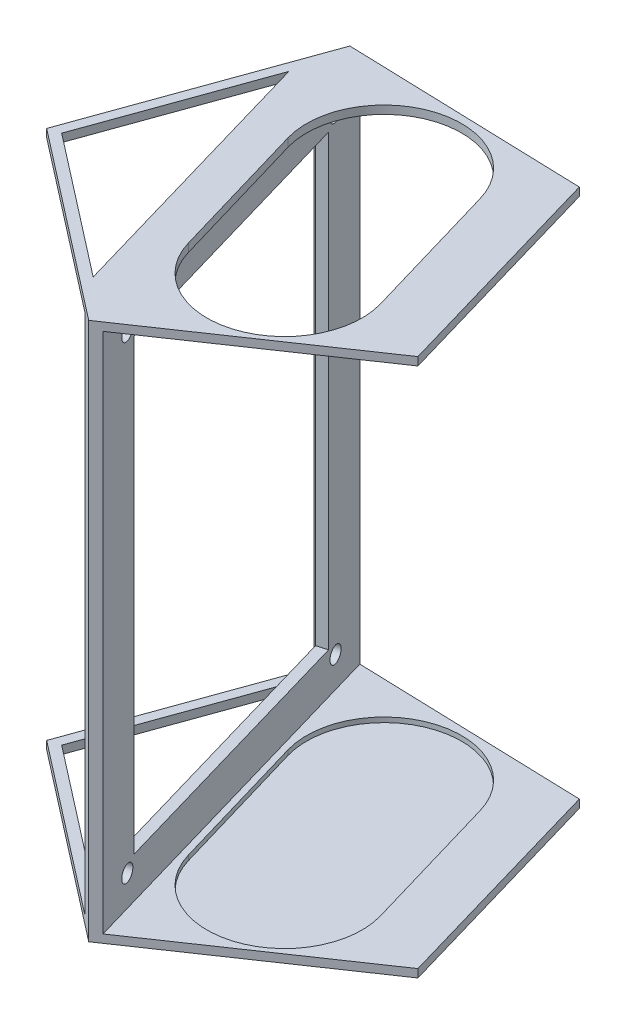
from build123d import *

# Parameters (mm, degrees)
BOSS_EXTRUDE1_DEPTH            = 1
BOSS_EXTRUDE2_DEPTH            = 65
SKETCH4_W                      = 40
SKETCH4_H                      = 60
CUT_EXTRUDE1_DEPTH             = 1.5
SKETCH5_W                      = 35
SKETCH5_H                      = 55
CUT_EXTRUDE2_DEPTH             = 1.3
BOSS_EXTRUDE3_DEPTH            = 1
CUT_EXTRUDE3_REACH             = 75.478
CUT_EXTRUDE3_DIRECTION_2_REACH = 75.478
CUT_EXTRUDE4_DEPTH             = 0.6
CUT_EXTRUDE4_DIRECTION_2_REACH = 75.478
SKETCH8_R                      = 1
CUT_EXTRUDE5_DEPTH             = 1.3


with BuildPart() as part:
    # Sketch1 → Boss-Extrude1 (new body)
    with BuildSketch(Plane(origin=(0, 0, 0), x_dir=(1, 0, 0), z_dir=(0, 1, 0))):
        Polygon((23.261119363, -8.370540245), (15.148938036, 19.535999959), (-13.898560763, 20.444452223), (-23.738720982, -6.900633603), (-0.772775653, -24.709278334), align=None)
    extrude(amount=BOSS_EXTRUDE1_DEPTH)

    # Sketch2 → Boss-Extrude2 (add)
    with BuildSketch(Plane(origin=(0, 1, 0), x_dir=(1, 0, 0), z_dir=(0, 1, 0))):
        Polygon((-2.923895425, -23.04122038), (-0.772775653, -24.709278334), (-13.898560763, 20.444452223), (-14.820245584, 17.883157492), align=None)
        Polygon((-13.898560763, 20.444452223), (-0.772775653, -24.709278334), (0.270689735, -23.999909017), (-12.637422708, 20.405010489), align=None)
    extrude(amount=BOSS_EXTRUDE2_DEPTH)

    # Sketch4 → Cut-Extrude1 (cut)
    with BuildSketch(Plane(origin=(-8.872070504, 0, 2.579031444), x_dir=(0.2791364928440536, 0, 0.9602514349704049), z_dir=(-0.9602514349704049, 0, 0.2791364928440536))):
        with Locations((0, 33.5)):
            Rectangle(SKETCH4_W, SKETCH4_H)
    extrude(amount=-CUT_EXTRUDE1_DEPTH, mode=Mode.SUBTRACT)

    # Sketch5 → Cut-Extrude2 (cut)
    with BuildSketch(Plane(origin=(-7.431693352, 0, 2.160326705), x_dir=(0.2791364928440537, 0, 0.9602514349704049), z_dir=(-0.9602514349704049, 0, 0.2791364928440537))):
        with Locations((0, 33.5)):
            Rectangle(SKETCH5_W, SKETCH5_H)
    extrude(amount=-CUT_EXTRUDE2_DEPTH, mode=Mode.SUBTRACT)

    # Sketch7 → Boss-Extrude3 (add)
    with BuildSketch(Plane(origin=(0, 66, 0), x_dir=(1, 0, 0), z_dir=(0, 1, 0))):
        Polygon((-0.772775653, -24.709278334), (23.261119363, -8.370540245), (15.148938036, 19.535999959), (-13.898560763, 20.444452223), (-23.738720982, -6.900633603), align=None)
    extrude(amount=-BOSS_EXTRUDE3_DEPTH)

    # Cut-Extrude3: up to this face of the body (flat: up to its plane)
    cut_extrude3_end = Plane(part.part.faces().sort_by_distance((0, 66, 0))[0])
    # Sketch6 → Cut-Extrude3 (cut, up to the picked face)
    with BuildSketch(Plane(origin=(0, 1, 0), x_dir=(1, 0, 0), z_dir=(0, 1, 0)), mode=Mode.PRIVATE) as cut_extrude3_sk1:
        Polygon((-22.314397723, -6.486595587), (-5.107109693, -19.829764132), (-14.941634759, 14.001773661), align=None)
    cut_extrude3_tool1 = split(extrude(cut_extrude3_sk1.sketch, amount=CUT_EXTRUDE3_REACH, mode=Mode.PRIVATE), bisect_by=cut_extrude3_end, keep=Keep.BOTH, mode=Mode.PRIVATE)
    add(cut_extrude3_tool1.solids().sort_by(Axis((-14.121047, 1, 4.104862), (0, 1, 0)))[0], mode=Mode.SUBTRACT)

    # Cut-Extrude3 direction 2: up to this face of the body (flat: up to its plane)
    cut_extrude3_direction_2_end = Plane(part.part.faces().sort_by_distance((0, 0, 0))[0])
    # Sketch6 → Cut-Extrude3 direction 2 (cut, up to the picked face)
    with BuildSketch(Plane(origin=(0, 1, 0), x_dir=(1, 0, 0), z_dir=(0, 1, 0)), mode=Mode.PRIVATE) as cut_extrude3_direction_2_sk1:
        Polygon((-22.314397723, -6.486595587), (-5.107109693, -19.829764132), (-14.941634759, 14.001773661), align=None)
    cut_extrude3_direction_2_tool1 = split(extrude(cut_extrude3_direction_2_sk1.sketch, amount=-CUT_EXTRUDE3_DIRECTION_2_REACH, mode=Mode.PRIVATE), bisect_by=cut_extrude3_direction_2_end, keep=Keep.BOTH, mode=Mode.PRIVATE)
    add(cut_extrude3_direction_2_tool1.solids().sort_by(Axis((-14.121047, 1, 4.104862), (0, -1, 0)))[0], mode=Mode.SUBTRACT)

    # Sketch3 → Cut-Extrude4 (cut)
    with BuildSketch(Plane(origin=(0, 1, 0), x_dir=(1, 0, 0), z_dir=(0, 1, 0))):
        with BuildLine():
            Line((10.293293236, 12.233810418), (15.358065736, -5.038944994))
            ThreePointArc((15.358065736, -5.038944994), (8.914963643, -16.828195836), (-2.874287199, -10.385093743))
            Line((-2.874287199, -10.385093743), (-7.939059699, 6.887661669))
            ThreePointArc((-7.939059699, 6.887661669), (-1.495957606, 18.676912511), (10.293293236, 12.233810418))
        make_face()
    extrude(amount=-CUT_EXTRUDE4_DEPTH, mode=Mode.SUBTRACT)

    # Cut-Extrude4 direction 2: up to this face of the body (flat: up to its plane)
    cut_extrude4_direction_2_end = Plane(part.part.faces().sort_by_distance((2.593442955, 66, -0.753890642))[0])
    # Sketch3 → Cut-Extrude4 direction 2 (cut, up to the picked face)
    with BuildSketch(Plane(origin=(0, 1, 0), x_dir=(1, 0, 0), z_dir=(0, 1, 0)), mode=Mode.PRIVATE) as cut_extrude4_direction_2_sk1:
        with BuildLine():
            Line((10.293293236, 12.233810418), (15.358065736, -5.038944994))
            ThreePointArc((15.358065736, -5.038944994), (8.914963643, -16.828195836), (-2.874287199, -10.385093743))
            Line((-2.874287199, -10.385093743), (-7.939059699, 6.887661669))
            ThreePointArc((-7.939059699, 6.887661669), (-1.495957606, 18.676912511), (10.293293236, 12.233810418))
        make_face()
    cut_extrude4_direction_2_tool1 = split(extrude(cut_extrude4_direction_2_sk1.sketch, amount=CUT_EXTRUDE4_DIRECTION_2_REACH, mode=Mode.PRIVATE), bisect_by=cut_extrude4_direction_2_end, keep=Keep.BOTH, mode=Mode.PRIVATE)
    add(cut_extrude4_direction_2_tool1.solids().sort_by(Axis((3.709503, 1, -0.924358), (0, 1, 0)))[0], mode=Mode.SUBTRACT)

    # Sketch8 → Cut-Extrude5 (cut)
    with BuildSketch(Plane(origin=(-7.431693352, 0, 2.160326705), x_dir=(0.2791364928440537, 0, 0.9602514349704049), z_dir=(-0.9602514349704049, 0, 0.2791364928440537))):
        with Locations((-18.75, 4.75)):
            Circle(SKETCH8_R)
        with Locations((18.75, 4.75)):
            Circle(SKETCH8_R)
        with Locations((-18.75, 62.25)):
            Circle(SKETCH8_R)
        with Locations((18.75, 62.25)):
            Circle(SKETCH8_R)
    extrude(amount=-CUT_EXTRUDE5_DEPTH, mode=Mode.SUBTRACT)


solid = part.part
